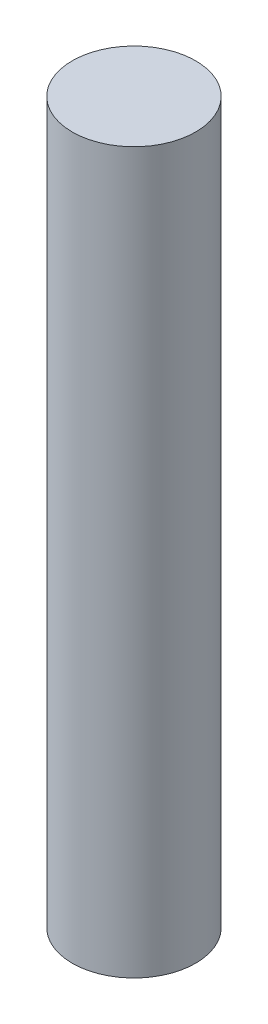
from build123d import *

# Parameters (mm, degrees)
CROQUIS2_R              = 2.4
SALIENTE_EXTRUIR1_DEPTH = 14


with BuildPart() as part:
    # Croquis2 → Saliente-Extruir1 (new, symmetric)
    with BuildSketch(Plane(origin=(0, 0, 0), x_dir=(1, 0, 0), z_dir=(0, 1, 0))):
        with Locations(Location((0, 0, 0), (0, 0, 270))):
            Circle(CROQUIS2_R)
    extrude(amount=SALIENTE_EXTRUIR1_DEPTH, both=True)


solid = part.part
